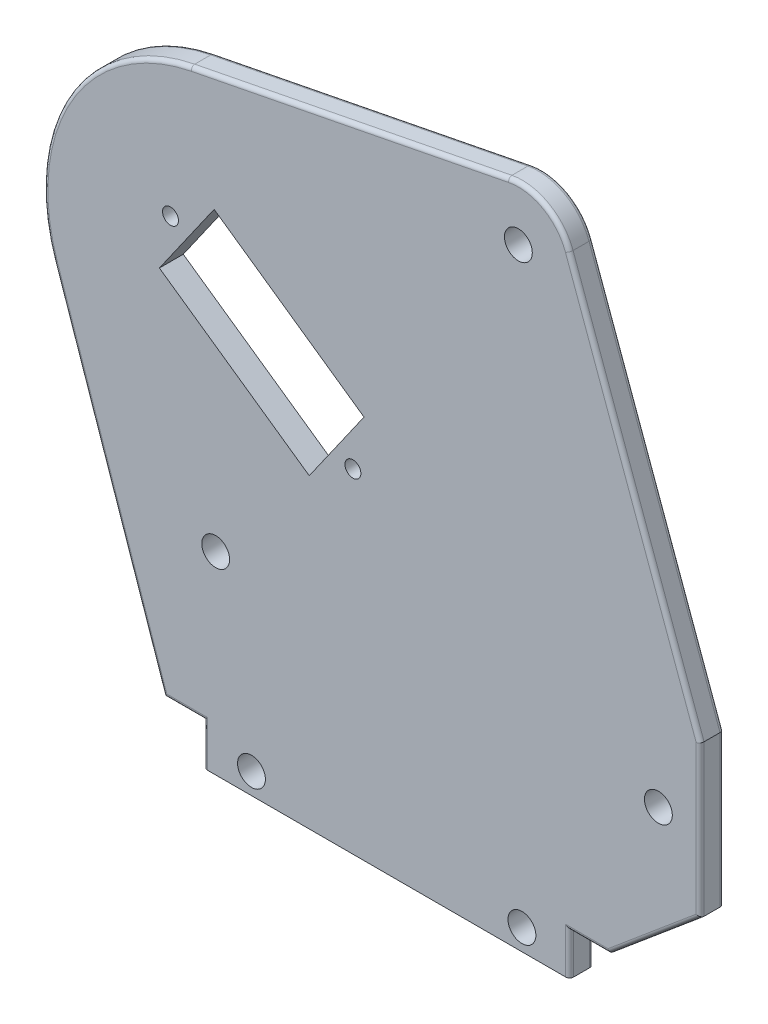
from build123d import *

# Parameters (mm, degrees)
SKETCH2_R               = 1
SKETCH2_R_2             = 1.75
BOSS_EXTRUDE1_DEPTH     = 1.5
FILLET1_R               = 0.5
FILLET2_R               = 0.5
CUT_EXTRUDE1_DEPTH      = 99.29192821
CUT_EXTRUDE1_DEPTH_BACK = 99.29192821
SKETCH3_W               = 46
SKETCH3_H               = 4.75


with BuildPart() as part:
    # Sketch2 → Boss-Extrude1 (new, symmetric)
    with BuildSketch(Plane.XY):
        with BuildLine():
            Line((39.405069621, 38.569989712), (22.934569539, 83.822316773))
            ThreePointArc((22.934569539, 83.822316773), (19.891485129, 87.41317775), (15.244648683, 88.162548371))
            Line((15.244648683, 88.162548371), (-24.631297069, 80.325625034))
            ThreePointArc((-24.631297069, 80.325625034), (-40.032912198, 69.313028262), (-41.860786126, 50.467712846))
            Line((-41.860786126, 50.467712846), (-28, 10))
            Line((-28, 10), (-23, 10))
            Line((-23, 10), (-23, 0))
            Line((-23, 0), (23, 0))
            Line((23, 0), (23, 10))
            Line((23, 10), (28, 10))
            Line((28, 10), (39.405069621, 19.569989712))
            Line((39.405069621, 19.569989712), (39.405069621, 38.569989712))
        make_face()
        with Locations((-27.182792376, 62.755399709)):
            Circle(SKETCH2_R, mode=Mode.SUBTRACT)
        with Locations((-4.246535136, 46.695259491)):
            Circle(SKETCH2_R, mode=Mode.SUBTRACT)
        with Locations((17, 7.4)):
            Circle(SKETCH2_R_2, mode=Mode.SUBTRACT)
        with Locations((-17, 7.4)):
            Circle(SKETCH2_R_2, mode=Mode.SUBTRACT)
        with Locations((34.155069621, 29.069989712)):
            Circle(SKETCH2_R_2, mode=Mode.SUBTRACT)
        with Locations((-21.5, 29.069989712)):
            Circle(SKETCH2_R_2, mode=Mode.SUBTRACT)
        with Locations((16.554056644, 81.5)):
            Circle(SKETCH2_R_2, mode=Mode.SUBTRACT)
        Polygon((-21.693453648, 66.236370884), (-28.576370884, 56.406546352), (-9.735873865, 43.214288316), (-2.852956629, 53.044112848), align=None, mode=Mode.SUBTRACT)
    extrude(amount=BOSS_EXTRUDE1_DEPTH, both=True)

    # Fillet1
    fillet1_edges = [part.edges().sort_by_distance(p)[0] for p in [
        (-40.032912198, 69.313028262, 1.5),
        (-34.930393063, 30.233856423, 1.5),
        (-25.5, 10, 1.5),
        (-23, 5, 1.5),
        (0, 0, 1.5),
        (23, 5, 1.5),
        (25.5, 10, 1.5),
        (33.70253481, 14.784994856, 1.5),
        (39.405069621, 29.069989712, 1.5),
        (31.16981958, 61.196153243, 1.5),
        (19.891485129, 87.41317775, 1.5),
        (-4.693324193, 84.244086702, 1.5),
    ]]
    fillet(fillet1_edges, radius=FILLET1_R)

    # Fillet2
    fillet2_edges = [part.edges().sort_by_distance(p)[0] for p in [
        (31.16981958, 61.196153243, -1.5),
        (39.405069621, 29.069989712, -1.5),
        (33.70253481, 14.784994856, -1.5),
        (25.5, 10, -1.5),
        (23, 5, -1.5),
        (0, 0, -1.5),
        (-23, 5, -1.5),
        (-25.5, 10, -1.5),
        (-34.930393063, 30.233856423, -1.5),
        (-40.032912198, 69.313028262, -1.5),
        (-4.693324193, 84.244086702, -1.5),
        (19.891485129, 87.41317775, -1.5),
    ]]
    fillet(fillet2_edges, radius=FILLET2_R)

    # Sketch3 → Cut-Extrude1 (cut, two sides: drawn at the far end of the back side and taken through both)
    with BuildSketch(Plane.XY.offset(1.5).offset(-CUT_EXTRUDE1_DEPTH_BACK)):
        with Locations((0, 2.375)):
            Rectangle(SKETCH3_W, SKETCH3_H)
    extrude(amount=CUT_EXTRUDE1_DEPTH + CUT_EXTRUDE1_DEPTH_BACK, mode=Mode.SUBTRACT)


solid = part.part
